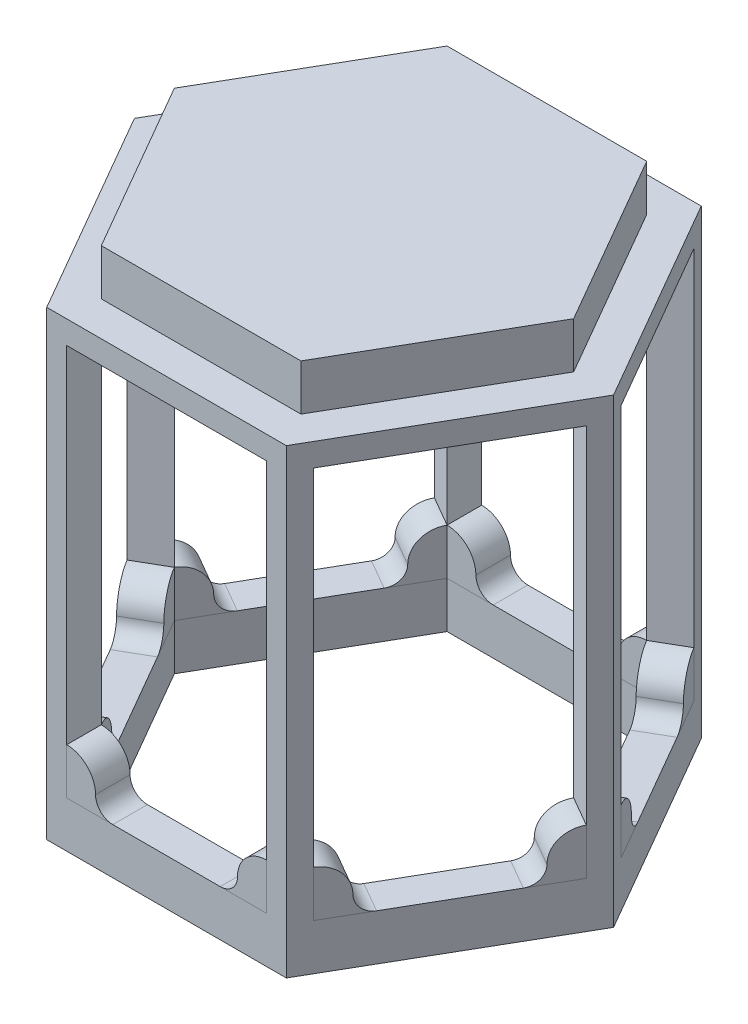
from build123d import *

# Parameters (mm, degrees)
BOSS_EXTRUDE1_DEPTH    = 2
BOSS_EXTRUDE2_DEPTH    = 17
BOSS_EXTRUDE3_DEPTH    = 1
BOSS_EXTRUDE4_DEPTH    = 2
BOSS_EXTRUDE12_DEPTH   = 1.5
BOSS_EXTRUDE12_2_DEPTH = 1.5
CIRPATTERN1_COUNT      = 6


with BuildPart() as part:
    # Sketch1 → Boss-Extrude1 (new body)
    with BuildSketch(Plane(origin=(0, 0, 0), x_dir=(1, 0, 0), z_dir=(0, 1, 0))):
        Polygon((10.392304845, 0), (5.196152423, 9), (-5.196152423, 9), (-10.392304845, 0), (-5.196152423, -9), (5.196152423, -9), align=None)
        Polygon((8.660254038, 0), (4.330127019, 7.5), (-4.330127019, 7.5), (-8.660254038, 0), (-4.330127019, -7.5), (4.330127019, -7.5), align=None, mode=Mode.SUBTRACT)
    extrude(amount=BOSS_EXTRUDE1_DEPTH)

    # Sketch2 → Boss-Extrude2 (add)
    with BuildSketch(Plane(origin=(0, 2, 0), x_dir=(1, 0, 0), z_dir=(0, 1, 0))):
        Polygon((-5.196152423, 9), (-5.629165125, 8.25), (-4.330127019, 7.5), (-4.330127019, 9), align=None)
        Polygon((4.330127019, 7.5), (5.629165125, 8.25), (5.196152423, 9), (4.330127019, 9), align=None)
        Polygon((8.660254038, 0), (9.959292144, -0.75), (10.392304845, 0), (9.959292144, 0.75), align=None)
        Polygon((4.330127019, -7.5), (4.330127019, -9), (5.196152423, -9), (5.629165125, -8.25), align=None)
        Polygon((-4.330127019, -7.5), (-5.629165125, -8.25), (-5.196152423, -9), (-4.330127019, -9), align=None)
        Polygon((-8.660254038, 0), (-9.959292144, 0.75), (-10.392304845, 0), (-9.959292144, -0.75), align=None)
    extrude(amount=BOSS_EXTRUDE2_DEPTH)

    # Sketch3 → Boss-Extrude3 (add)
    with BuildSketch(Plane(origin=(0, 19, 0), x_dir=(1, 0, 0), z_dir=(0, 1, 0))):
        Polygon((10.392304845, 0), (5.196152423, 9), (-5.196152423, 9), (-10.392304845, 0), (-5.196152423, -9), (5.196152423, -9), align=None)
    extrude(amount=BOSS_EXTRUDE3_DEPTH)

    # Sketch4 → Boss-Extrude4 (add)
    with BuildSketch(Plane(origin=(0, 20, 0), x_dir=(1, 0, 0), z_dir=(0, 1, 0))):
        Polygon((8.660254038, 0), (4.330127019, 7.5), (-4.330127019, 7.5), (-8.660254038, 0), (-4.330127019, -7.5), (4.330127019, -7.5), align=None)
    extrude(amount=BOSS_EXTRUDE4_DEPTH)


with BuildPart() as body_2:
    # Sketch5 → Boss-Extrude12 (new body)
    with BuildSketch(Plane.XY.offset(-7.5)):
        with BuildLine():
            Line((-4.330127019, 2), (-2.330127019, 2))
            ThreePointArc((-2.330127019, 2), (-2.860457105, 2.219669914), (-3.080127019, 2.75))
            ThreePointArc((-3.080127019, 2.75), (-3.446243542, 3.633883476), (-4.330127019, 4))
            Line((-4.330127019, 4), (-4.330127019, 2.75))
            Line((-4.330127019, 2.75), (-4.330127019, 2))
        make_face()
    extrude(amount=-BOSS_EXTRUDE12_DEPTH)


with BuildPart() as body_3:
    # Sketch5 → Boss-Extrude12 2 (new body)
    with BuildSketch(Plane.XY.offset(-7.5)):
        with BuildLine():
            Line((4.330127019, 2), (4.330127019, 2.75))
            Line((4.330127019, 2.75), (4.330127019, 4))
            ThreePointArc((4.330127019, 4), (3.446243542, 3.633883476), (3.080127019, 2.75))
            ThreePointArc((3.080127019, 2.75), (2.860457105, 2.219669914), (2.330127019, 2))
            Line((2.330127019, 2), (4.330127019, 2))
        make_face()
    extrude(amount=-BOSS_EXTRUDE12_2_DEPTH)


with BuildPart() as cirpattern1_1:
    # CirPattern1: pattern copy
    add(body_3.part.rotate(Axis((0, 0, 0), (0, 1, 0)), 1 * 360 / CIRPATTERN1_COUNT))


with BuildPart() as cirpattern1_2:
    # CirPattern1: pattern copy
    add(body_3.part.rotate(Axis((0, 0, 0), (0, 1, 0)), 2 * 360 / CIRPATTERN1_COUNT))


with BuildPart() as cirpattern1_3:
    # CirPattern1: pattern copy
    add(body_3.part.rotate(Axis((0, 0, 0), (0, 1, 0)), 3 * 360 / CIRPATTERN1_COUNT))


with BuildPart() as cirpattern1_4:
    # CirPattern1: pattern copy
    add(body_3.part.rotate(Axis((0, 0, 0), (0, 1, 0)), 4 * 360 / CIRPATTERN1_COUNT))


with BuildPart() as cirpattern1_5:
    # CirPattern1: pattern copy
    add(body_3.part.rotate(Axis((0, 0, 0), (0, 1, 0)), 5 * 360 / CIRPATTERN1_COUNT))


with BuildPart() as cirpattern1_6:
    # CirPattern1: pattern copy
    add(body_2.part.rotate(Axis((0, 0, 0), (0, 1, 0)), 1 * 360 / CIRPATTERN1_COUNT))


with BuildPart() as cirpattern1_7:
    # CirPattern1: pattern copy
    add(body_2.part.rotate(Axis((0, 0, 0), (0, 1, 0)), 2 * 360 / CIRPATTERN1_COUNT))


with BuildPart() as cirpattern1_8:
    # CirPattern1: pattern copy
    add(body_2.part.rotate(Axis((0, 0, 0), (0, 1, 0)), 3 * 360 / CIRPATTERN1_COUNT))


with BuildPart() as cirpattern1_9:
    # CirPattern1: pattern copy
    add(body_2.part.rotate(Axis((0, 0, 0), (0, 1, 0)), 4 * 360 / CIRPATTERN1_COUNT))


with BuildPart() as cirpattern1_10:
    # CirPattern1: pattern copy
    add(body_2.part.rotate(Axis((0, 0, 0), (0, 1, 0)), 5 * 360 / CIRPATTERN1_COUNT))


solid = Compound([part.part, body_2.part, body_3.part, cirpattern1_1.part, cirpattern1_2.part, cirpattern1_3.part, cirpattern1_4.part, cirpattern1_5.part, cirpattern1_6.part, cirpattern1_7.part, cirpattern1_8.part, cirpattern1_9.part, cirpattern1_10.part])
